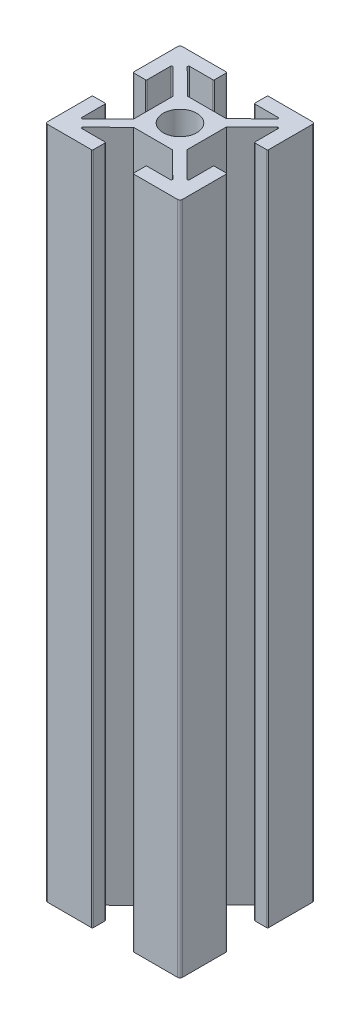
from build123d import *

# Parameters (mm, degrees)
SKETCH1_R           = 2.5
BOSS_EXTRUDE1_DEPTH = 100
SKETCH2_R           = 2.5
CUT_EXTRUDE1_DEPTH  = 1


with BuildPart() as part:
    # Sketch1 → Boss-Extrude1 (new body)
    with BuildSketch(Plane(origin=(0, 0, 0), x_dir=(1, 0, 0), z_dir=(0, 1, 0))):
        with BuildLine():
            Line((-5.357713917, -5.679481981), (-3.657713917, -5.679481981))
            ThreePointArc((-3.657713917, -5.679481981), (-3.5516479, -5.635547998), (-3.507713917, -5.529481981))
            Line((-3.507713917, -5.529481981), (-3.507713917, -2.093297468))
            ThreePointArc((-3.507713917, -2.093297468), (-3.415514871, -1.954881249), (-3.252259921, -1.98662294))
            Line((-3.252259921, -1.98662294), (0.53858238, -5.734091759))
            Line((0.53858238, -5.734091759), (0.53858238, -11.624872203))
            Line((0.53858238, -11.624872203), (-3.252259921, -15.372341022))
            ThreePointArc((-3.252259921, -15.372341022), (-3.415514871, -15.404082713), (-3.507713917, -15.265666494))
            Line((-3.507713917, -15.265666494), (-3.507713917, -11.829481981))
            ThreePointArc((-3.507713917, -11.829481981), (-3.5516479, -11.723415964), (-3.657713917, -11.679481981))
            Line((-3.657713917, -11.679481981), (-5.357713917, -11.679481981))
            ThreePointArc((-5.357713917, -11.679481981), (-5.463779934, -11.723415964), (-5.507713917, -11.829481981))
            Line((-5.507713917, -11.829481981), (-5.507713917, -18.329481981))
            ThreePointArc((-5.507713917, -18.329481981), (-5.40520129, -18.576969354), (-5.157713917, -18.679481981))
            Line((-5.157713917, -18.679481981), (1.342286083, -18.679481981))
            ThreePointArc((1.342286083, -18.679481981), (1.4483521, -18.635547998), (1.492286083, -18.529481981))
            Line((1.492286083, -18.529481981), (1.492286083, -16.829481981))
            ThreePointArc((1.492286083, -16.829481981), (1.4483521, -16.723415964), (1.342286083, -16.679481981))
            Line((1.342286083, -16.679481981), (-2.075798714, -16.679481981))
            ThreePointArc((-2.075798714, -16.679481981), (-2.214545208, -16.586485581), (-2.181252709, -16.422807453))
            Line((-2.181252709, -16.422807453), (1.605398289, -12.679481981))
            Line((1.605398289, -12.679481981), (7.379173877, -12.679481981))
            Line((7.379173877, -12.679481981), (11.165824876, -16.422807453))
            ThreePointArc((11.165824876, -16.422807453), (11.199117374, -16.586485581), (11.06037088, -16.679481981))
            Line((11.06037088, -16.679481981), (7.642286083, -16.679481981))
            ThreePointArc((7.642286083, -16.679481981), (7.536220066, -16.723415964), (7.492286083, -16.829481981))
            Line((7.492286083, -16.829481981), (7.492286083, -18.529481981))
            ThreePointArc((7.492286083, -18.529481981), (7.536220066, -18.635547998), (7.642286083, -18.679481981))
            Line((7.642286083, -18.679481981), (14.142286083, -18.679481981))
            ThreePointArc((14.142286083, -18.679481981), (14.389773457, -18.576969354), (14.492286083, -18.329481981))
            Line((14.492286083, -18.329481981), (14.492286083, -11.829481981))
            ThreePointArc((14.492286083, -11.829481981), (14.4483521, -11.723415964), (14.342286083, -11.679481981))
            Line((14.342286083, -11.679481981), (12.642286083, -11.679481981))
            ThreePointArc((12.642286083, -11.679481981), (12.536220066, -11.723415964), (12.492286083, -11.829481981))
            Line((12.492286083, -11.829481981), (12.492286083, -15.265666494))
            ThreePointArc((12.492286083, -15.265666494), (12.400087038, -15.404082713), (12.236832088, -15.372341022))
            Line((12.236832088, -15.372341022), (8.445989787, -11.624872203))
            Line((8.445989787, -11.624872203), (8.445989787, -5.734091759))
            Line((8.445989787, -5.734091759), (12.236832088, -1.98662294))
            ThreePointArc((12.236832088, -1.98662294), (12.400087038, -1.954881249), (12.492286083, -2.093297468))
            Line((12.492286083, -2.093297468), (12.492286083, -5.529481981))
            ThreePointArc((12.492286083, -5.529481981), (12.536220066, -5.635547998), (12.642286083, -5.679481981))
            Line((12.642286083, -5.679481981), (14.342286083, -5.679481981))
            ThreePointArc((14.342286083, -5.679481981), (14.4483521, -5.635547998), (14.492286083, -5.529481981))
            Line((14.492286083, -5.529481981), (14.492286083, 0.970518019))
            ThreePointArc((14.492286083, 0.970518019), (14.389773457, 1.218005392), (14.142286083, 1.320518019))
            Line((14.142286083, 1.320518019), (7.642286083, 1.320518019))
            ThreePointArc((7.642286083, 1.320518019), (7.536220066, 1.276584036), (7.492286083, 1.170518019))
            Line((7.492286083, 1.170518019), (7.492286083, -0.529481981))
            ThreePointArc((7.492286083, -0.529481981), (7.536220066, -0.635547998), (7.642286083, -0.679481981))
            Line((7.642286083, -0.679481981), (11.06037088, -0.679481981))
            ThreePointArc((11.06037088, -0.679481981), (11.199117374, -0.772478381), (11.165824876, -0.936156509))
            Line((11.165824876, -0.936156509), (7.379173877, -4.679481981))
            Line((7.379173877, -4.679481981), (1.605398289, -4.679481981))
            Line((1.605398289, -4.679481981), (-2.181252709, -0.936156509))
            ThreePointArc((-2.181252709, -0.936156509), (-2.214545208, -0.772478381), (-2.075798714, -0.679481981))
            Line((-2.075798714, -0.679481981), (1.342286083, -0.679481981))
            ThreePointArc((1.342286083, -0.679481981), (1.4483521, -0.635547998), (1.492286083, -0.529481981))
            Line((1.492286083, -0.529481981), (1.492286083, 1.170518019))
            ThreePointArc((1.492286083, 1.170518019), (1.4483521, 1.276584036), (1.342286083, 1.320518019))
            Line((1.342286083, 1.320518019), (-5.157713917, 1.320518019))
            ThreePointArc((-5.157713917, 1.320518019), (-5.40520129, 1.218005392), (-5.507713917, 0.970518019))
            Line((-5.507713917, 0.970518019), (-5.507713917, -5.529481981))
            ThreePointArc((-5.507713917, -5.529481981), (-5.463779934, -5.635547998), (-5.357713917, -5.679481981))
        make_face()
        with Locations(Location((4.492286083, -8.679481981, 0), (0, 0, 270))):
            Circle(SKETCH1_R, mode=Mode.SUBTRACT)
    extrude(amount=BOSS_EXTRUDE1_DEPTH)

    # Sketch2 → Cut-Extrude1 (cut)
    with BuildSketch(Plane.XY.offset(12.679481981)):
        with Locations((4.492286083, 53.418394615)):
            Circle(SKETCH2_R)
        with Locations((4.492286083, 93.418394615)):
            Circle(SKETCH2_R)
    extrude(amount=-CUT_EXTRUDE1_DEPTH, mode=Mode.SUBTRACT)


solid = part.part
